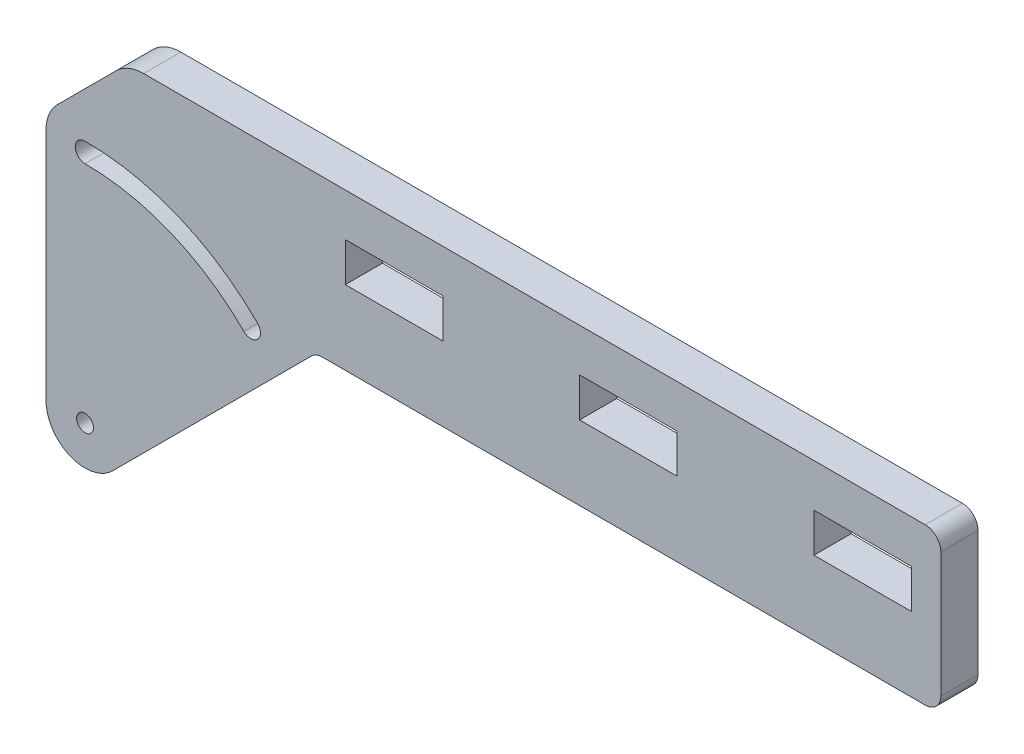
from build123d import *

# Parameters (mm, degrees)
SKETCH1_R           = 1.3716
BOSS_EXTRUDE1_DEPTH = 6.0452
SKETCH2_W           = 15.875
SKETCH2_H           = 6.35
CUT_EXTRUDE1_DEPTH  = 6.0452


with BuildPart() as part:
    # Sketch1 → Boss-Extrude1 (new body)
    with BuildSketch(Plane.XY):
        with BuildLine():
            Line((-6.35, 38.1), (-6.35, 0))
            ThreePointArc((-6.35, 0), (-2.430039796, -5.866635031), (4.490128061, -4.490128061))
            Line((4.490128061, -4.490128061), (31.430896424, 22.450640303))
            Line((31.430896424, 22.450640303), (36.811307345, 27.831051224))
            ThreePointArc((36.811307345, 27.831051224), (37.635342651, 28.381654013), (38.607358569, 28.575))
            Line((38.607358569, 28.575), (136.615256121, 28.575))
            ThreePointArc((136.615256121, 28.575), (138.411307345, 29.318948776), (139.155256121, 31.115))
            Line((139.155256121, 31.115), (139.155256121, 51.435))
            ThreePointArc((139.155256121, 51.435), (138.411307345, 53.231051224), (136.615256121, 53.975))
            Line((136.615256121, 53.975), (9.525, 53.975))
            ThreePointArc((9.525, 53.975), (7.094960204, 53.491635031), (5.034871939, 52.115128061))
            Line((5.034871939, 52.115128061), (-4.490128061, 42.590128061))
            ThreePointArc((-4.490128061, 42.590128061), (-5.866635031, 40.530039796), (-6.35, 38.1))
        make_face()
        Circle(SKETCH1_R, mode=Mode.SUBTRACT)
        with BuildLine():
            ThreePointArc((25.818236348, 25.818236348), (13.972728824, 33.733151431), (0, 36.5125))
            ThreePointArc((0, 36.5125), (-1.5875, 38.1), (0, 39.6875))
            ThreePointArc((0, 39.6875), (15.187748722, 36.666468947), (28.063300378, 28.063300378))
            ThreePointArc((28.063300378, 28.063300378), (28.063300378, 25.818236348), (25.818236348, 25.818236348))
        make_face(mode=Mode.SUBTRACT)
    extrude(amount=BOSS_EXTRUDE1_DEPTH)

    # Sketch2 → Cut-Extrude1 (cut)
    with BuildSketch(Plane.XY.offset(6.0452)):
        with Locations((126.455256121, 43.815)):
            Rectangle(SKETCH2_W, SKETCH2_H)
        with Locations((88.355256121, 43.815)):
            Rectangle(SKETCH2_W, SKETCH2_H)
        with Locations((50.255256121, 43.815)):
            Rectangle(SKETCH2_W, SKETCH2_H)
    extrude(amount=-CUT_EXTRUDE1_DEPTH, mode=Mode.SUBTRACT)


solid = part.part
